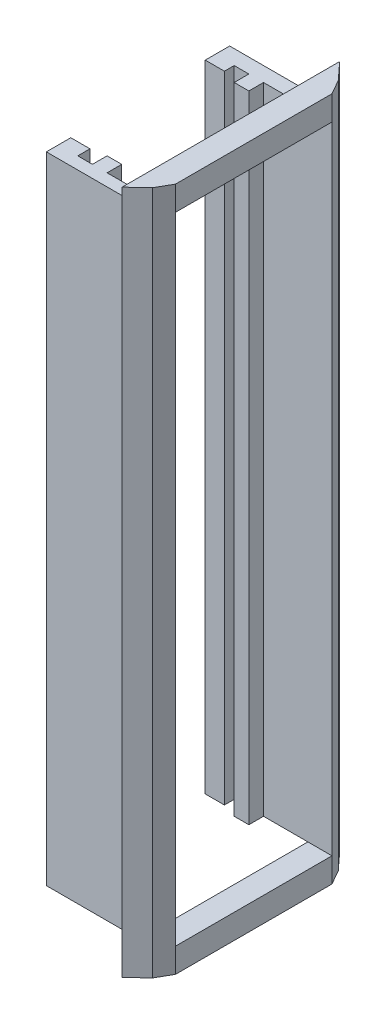
from build123d import *

# Parameters (mm, degrees)
BOSS_EXTRUDE2_DEPTH = 130
BOSS_EXTRUDE3_DEPTH = 5
BOSS_EXTRUDE4_DEPTH = 5
CUT_EXTRUDE2_DEPTH  = 6


with BuildPart() as part:
    # Sketch1 → Boss-Extrude2 (new body)
    with BuildSketch(Plane(origin=(0, 0, 0), x_dir=(1, 0, 0), z_dir=(0, 1, 0))):
        Polygon((0, -3), (0, 29), (3, 29), (3, 26), (6, 26), (6, 29), (20, 29), (18.290622359, 32), (15.075355057, 35.5), (15.075355057, 32), (-3.924644943, 32), (-3.924644943, -5.5), (15.075355057, -5.5), (15.075355057, -9), (18.290622359, -6), (20, -3), (6, -3), (6, 0), (3, 0), (3, -3), align=None)
    extrude(amount=BOSS_EXTRUDE2_DEPTH)

    # Sketch2 → Boss-Extrude3 (add)
    with BuildSketch(Plane(origin=(0, 130, 0), x_dir=(1, 0, 0), z_dir=(0, 1, 0))):
        Polygon((15.075355057, 35.5), (15.075355057, -9), (18.290622359, -6), (20, -3), (20, 29), (18.290622359, 32), align=None)
    extrude(amount=BOSS_EXTRUDE3_DEPTH)

    # Sketch3 → Boss-Extrude4 (add)
    with BuildSketch(Plane.XZ):
        Polygon((15.075355057, 9), (15.075355057, -35.5), (18.290622359, -32), (20, -29), (20, 3), (18.290622359, 6), align=None)
    extrude(amount=BOSS_EXTRUDE4_DEPTH)

    # Sketch4 → Cut-Extrude2 (cut)
    with BuildSketch(Plane.ZY.offset(3.924644943)):
        Polygon((0.5, 5), (0.5, 125), (0.5, 130), (-27, 130), (-27, 125), (-27, 5), (-27, 0), (0.5, 0), align=None)
    extrude(amount=-CUT_EXTRUDE2_DEPTH, mode=Mode.SUBTRACT)


solid = part.part
